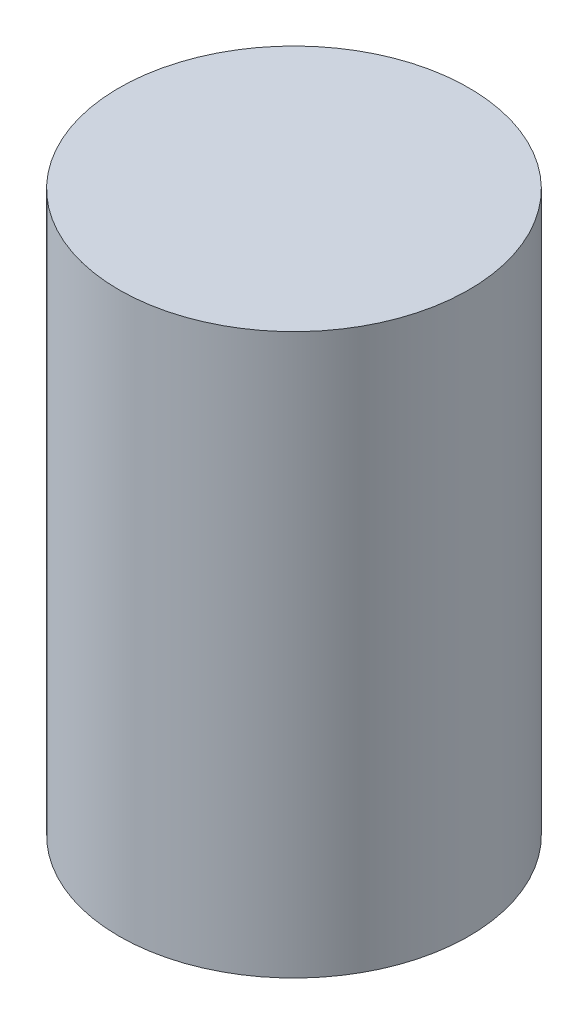
from build123d import *

# Parameters (mm, degrees)
SKETCH1_R           = 2.5
BOSS_EXTRUDE1_DEPTH = 8


with BuildPart() as part:
    # Sketch1 → Boss-Extrude1 (new body)
    with BuildSketch(Plane(origin=(0, 0, 0), x_dir=(1, 0, 0), z_dir=(0, 1, 0))):
        with Locations(Location((0, 0, 0), (0, 0, 270))):
            Circle(SKETCH1_R)
    extrude(amount=BOSS_EXTRUDE1_DEPTH)


solid = part.part
